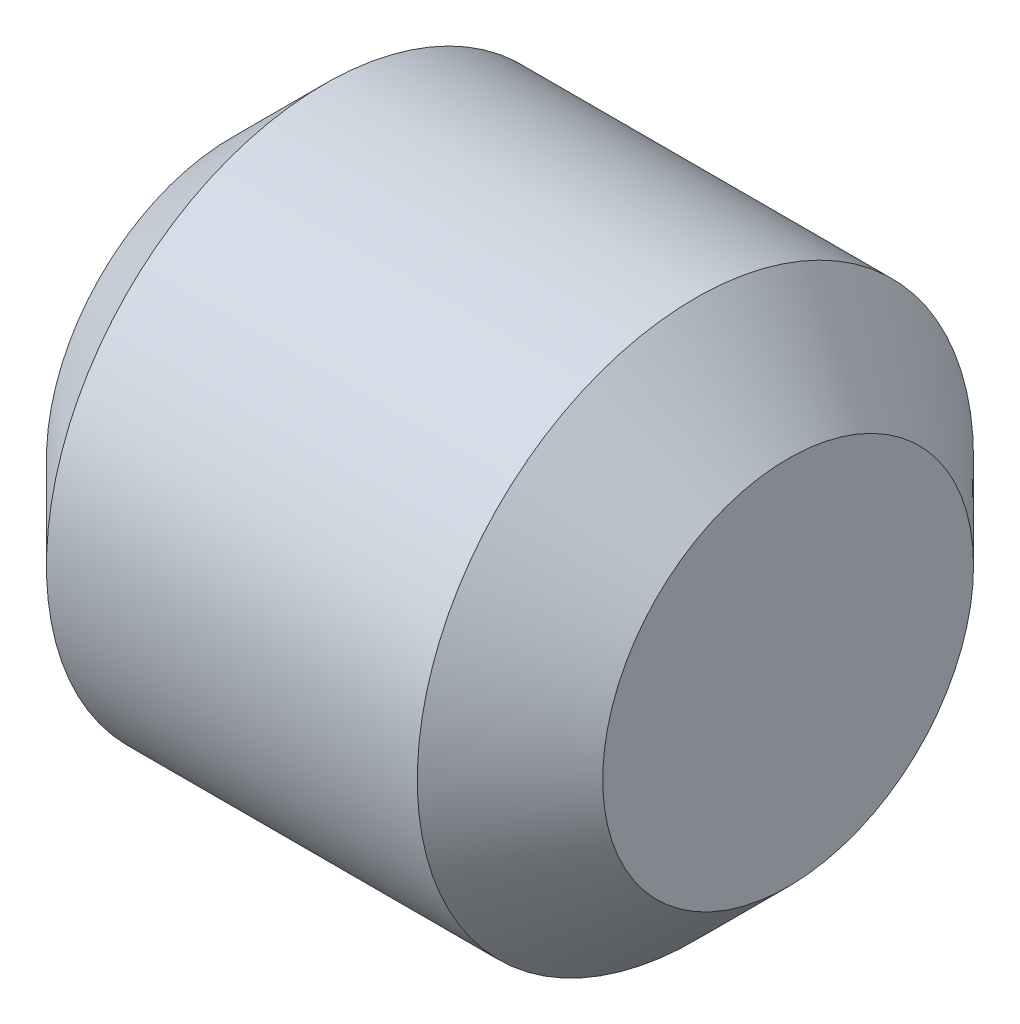
from build123d import *

# Parameters (mm, degrees)
SKETCH1_R           = 300
BOSS_EXTRUDE1_DEPTH = 400
SKETCH1_2_R         = 300
BOSS_EXTRUDE2_DEPTH = 100
BOSS_EXTRUDE2_DRAFT = -45
BOSS_EXTRUDE3_START = 400
SKETCH1_3_R         = 300
BOSS_EXTRUDE3_DEPTH = 100
BOSS_EXTRUDE3_TAPER = 45


with BuildPart() as part:
    # Sketch1 → Boss-Extrude1 (new body)
    with BuildSketch(Plane(origin=(0, 0, 0), x_dir=(0, 0, -1), z_dir=(1, 0, 0))):
        Circle(SKETCH1_R)
    extrude(amount=BOSS_EXTRUDE1_DEPTH)


with BuildPart() as boss_extrude2_tool:
    # Sketch1<2> → Boss-Extrude2 (with draft: the straight prism first)
    with BuildSketch(Plane(origin=(0, 0, 0), x_dir=(0, 0, -1), z_dir=(1, 0, 0))):
        Circle(SKETCH1_2_R)
    extrude(amount=-BOSS_EXTRUDE2_DEPTH)
    # Boss-Extrude2: the draft: its side faces are tilted about the plane it starts from
    boss_extrude2_sides = [boss_extrude2_tool.faces().sort_by_distance(p)[0] for p in [
        (-50, 0, 300),
    ]]
    draft(boss_extrude2_sides, Plane(origin=(0, 0, 0), x_dir=(0, 0, -1), z_dir=(1, 0, 0)), BOSS_EXTRUDE2_DRAFT)


with BuildPart() as part_1:
    add(part.part)

    # Boss-Extrude2: add boss_extrude2_tool
    add(boss_extrude2_tool.part)

    # Sketch1<3> → Boss-Extrude3 (add)
    with BuildSketch(Plane(origin=(0, 0, 0), x_dir=(0, 0, -1), z_dir=(1, 0, 0)).offset(BOSS_EXTRUDE3_START)):
        Circle(SKETCH1_3_R)
    extrude(amount=BOSS_EXTRUDE3_DEPTH, taper=BOSS_EXTRUDE3_TAPER)


solid = part_1.part
